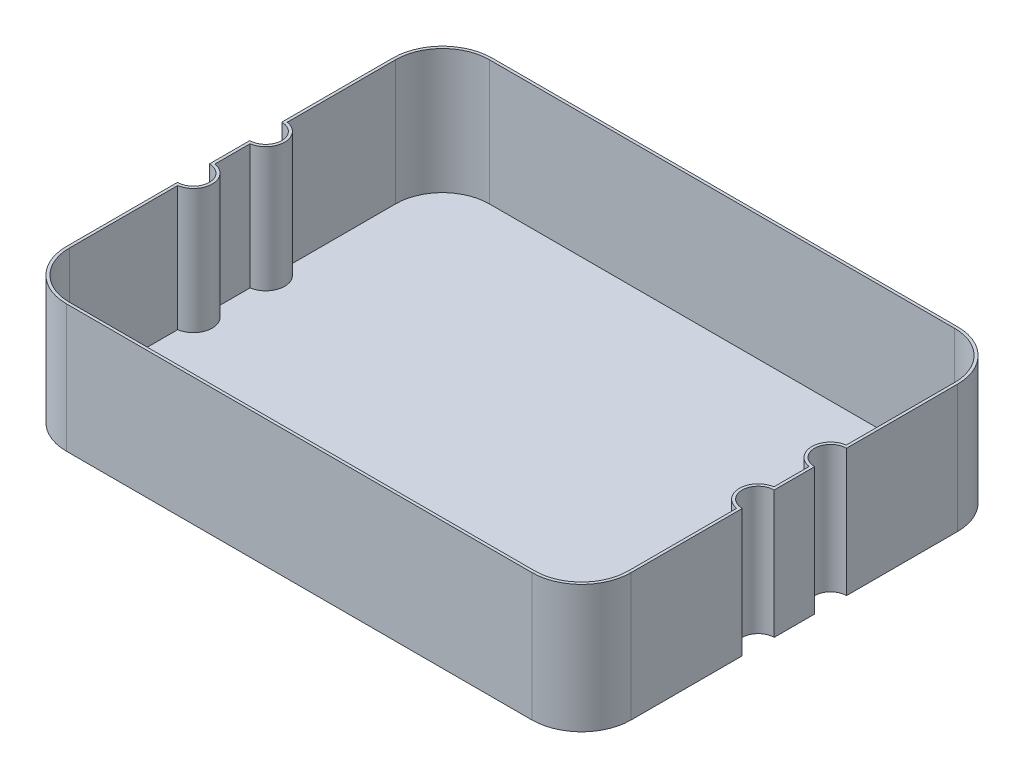
from build123d import *

# Parameters (mm, degrees)
SKETCH_1_W          = 398
SKETCH_1_H          = 300
EXTRUDE_1_DEPTH     = 90
FILLET_1_R          = 35
SKETCH_2_R          = 11.25
CUT_EXTRUDE_1_DEPTH = 90
SHELL_1_T           = -2


with BuildPart() as part:
    # 草图1 → 凸台-拉伸1 (new body)
    with BuildSketch(Plane(origin=(0, 0, 0), x_dir=(1, 0, 0), z_dir=(0, 1, 0))):
        Rectangle(SKETCH_1_W, SKETCH_1_H)
    extrude(amount=EXTRUDE_1_DEPTH)

    # 圆角1
    fillet_1_edges = [part.edges().sort_by_distance(p)[0] for p in [
        (199, 45, 150),
        (-199, 45, 150),
        (-199, 45, -150),
        (199, 45, -150),
    ]]
    fillet(fillet_1_edges, radius=FILLET_1_R)

    # 草图2 → 切除-拉伸1 (cut)
    with BuildSketch(Plane(origin=(0, 90, 0), x_dir=(1, 0, 0), z_dir=(0, 1, 0))):
        with Locations((-199, 25.5)):
            Circle(SKETCH_2_R)
        with Locations((-199, -25.5)):
            Circle(SKETCH_2_R)
        with Locations((199, -25.5)):
            Circle(SKETCH_2_R)
        with Locations((199, 25.5)):
            Circle(SKETCH_2_R)
    extrude(amount=-CUT_EXTRUDE_1_DEPTH, mode=Mode.SUBTRACT)

    # 抽壳1
    shell_1_openings = [part.faces().sort_by_distance(p)[0] for p in [
        (0, 90, 0),
    ]]
    offset(amount=SHELL_1_T, openings=shell_1_openings, kind=Kind.INTERSECTION)


solid = part.part
